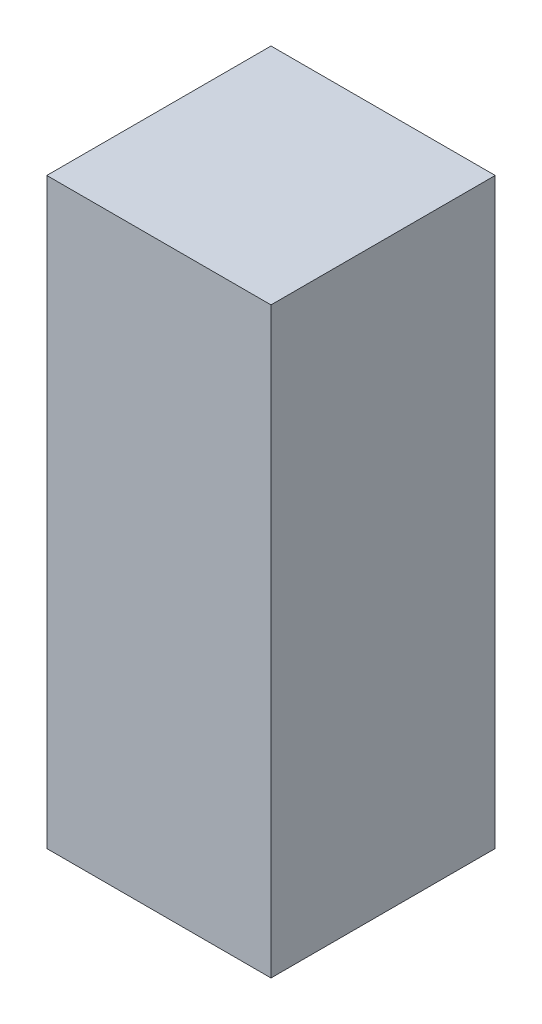
from build123d import *

# Parameters (mm, degrees)
SK_P01_MICROFIT306POSMATED_W  = 10
SK_P01_MICROFIT306POSMATED_H  = 10
P01_MICROFIT306POSMATED_DEPTH = 26


with BuildPart() as part:
    # SK_P01_MicroFit306posmated → P01_MicroFit306posmated (new body)
    with BuildSketch(Plane(origin=(0, 0, 0), x_dir=(1, 0, 0), z_dir=(0, 1, 0))):
        Rectangle(SK_P01_MICROFIT306POSMATED_W, SK_P01_MICROFIT306POSMATED_H)
    extrude(amount=P01_MICROFIT306POSMATED_DEPTH)


solid = part.part
